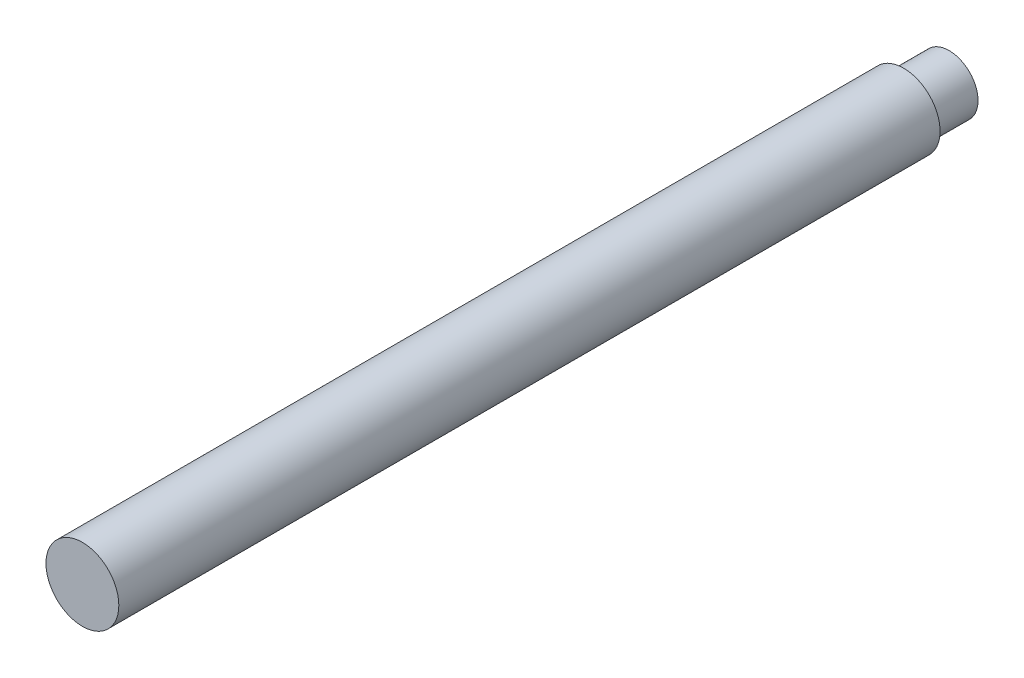
from build123d import *

# Parameters (mm, degrees)
SKETCH1_R           = 4.0005
BOSS_EXTRUDE1_DEPTH = 95.25
SKETCH2_R           = 6.466915926
SKETCH2_R_2         = 3.175
CUT_EXTRUDE1_DEPTH  = 5


with BuildPart() as part:
    # Sketch1 → Boss-Extrude1 (new body)
    with BuildSketch(Plane.XY):
        Circle(SKETCH1_R)
    extrude(amount=BOSS_EXTRUDE1_DEPTH)

    # Sketch2 → Cut-Extrude1 (cut)
    with BuildSketch(Plane(origin=(0, 0, 0), x_dir=(-1, 0, 0), z_dir=(0, 0, -1))):
        Circle(SKETCH2_R)
        Circle(SKETCH2_R_2, mode=Mode.SUBTRACT)
    extrude(amount=-CUT_EXTRUDE1_DEPTH, mode=Mode.SUBTRACT)


solid = part.part
